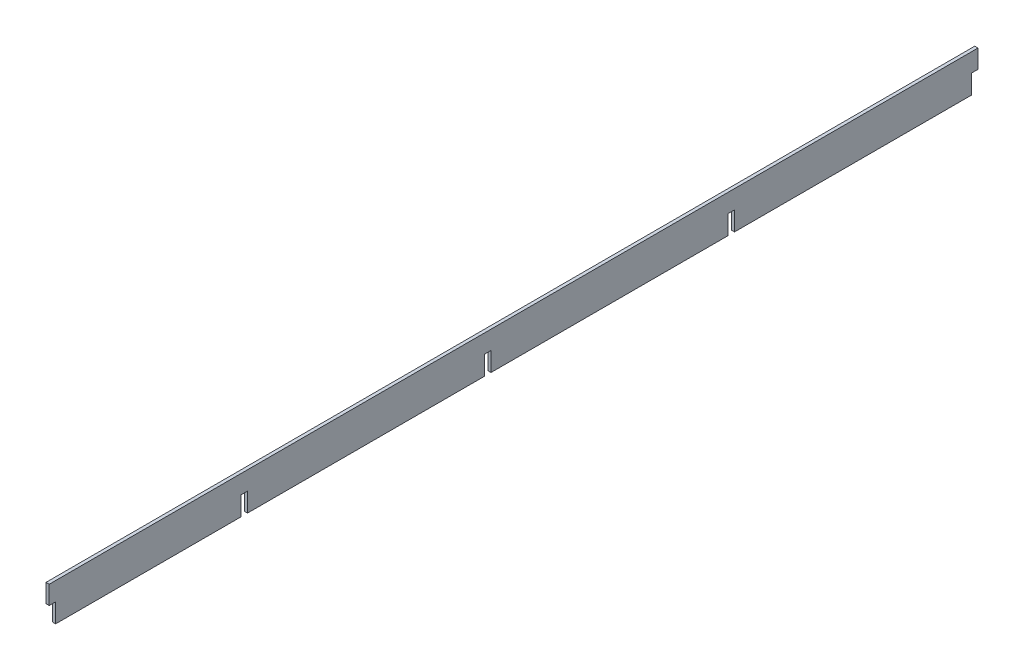
from build123d import *

# Parameters (mm, degrees)
BOSS_EXTRUDE1_DEPTH = 1.5875


with BuildPart() as part:
    # Sketch1 → Boss-Extrude1 (new body)
    with BuildSketch(Plane(origin=(329.313936241, 0, 0), x_dir=(0, 0, -1), z_dir=(1, 0, 0))):
        Polygon((-319.681194078, 425.766786018), (-322.856194078, 425.766786018), (-773.706194078, 425.766786018), (-776.881194078, 425.766786018), (-776.881194078, 416.670628572), (-773.706194078, 416.670628572), (-773.706194078, 407.27995149), (-682.424944078, 407.27995149), (-682.424944078, 416.670628572), (-679.249944078, 416.670628572), (-679.249944078, 407.27995149), (-562.568694078, 407.27995149), (-562.568694078, 416.670628572), (-559.393694078, 416.670628572), (-559.393694078, 407.27995149), (-442.712444078, 407.27995149), (-442.712444078, 416.670628572), (-439.537444078, 416.670628572), (-439.537444078, 407.27995149), (-322.856194078, 407.27995149), (-322.856194078, 416.670628572), (-319.681194078, 416.670628572), align=None)
    extrude(amount=BOSS_EXTRUDE1_DEPTH)


solid = part.part
